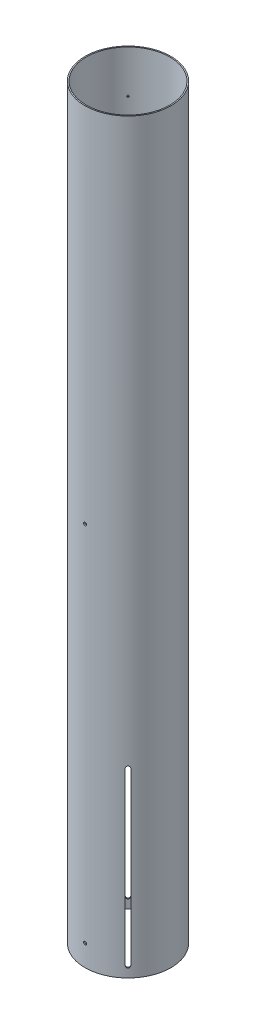
from build123d import *

# Parameters (mm, degrees)
SKETCH1_R           = 51.054
SKETCH1_R_2         = 49.657
BOSS_EXTRUDE1_DEPTH = 887.984
CUT_EXTRUDE1_DEPTH  = 152.4
CIRPATTERN1_COUNT   = 4
SKETCH3_R           = 1.7653
CUT_EXTRUDE2_DEPTH  = 11.684
SKETCH4_R           = 1.0922
CUT_EXTRUDE3_DEPTH  = 25.4
CIRPATTERN2_COUNT   = 2


with BuildPart() as part:
    # Sketch1 → Boss-Extrude1 (new body)
    with BuildSketch(Plane(origin=(0, 0, 0), x_dir=(1, 0, 0), z_dir=(0, 1, 0))):
        with Locations(Location((0, 0, 0), (0, 0, 270))):
            Circle(SKETCH1_R)
        with Locations(Location((0, 0, 0), (0, 0, 270))):
            Circle(SKETCH1_R_2, mode=Mode.SUBTRACT)
    extrude(amount=BOSS_EXTRUDE1_DEPTH)

    # Sketch2 → Cut-Extrude1 (cut)
    with BuildSketch(Plane(origin=(14.510077607, 1243.355570529, -192.646470594), x_dir=(0, 1, 0), z_dir=(0.7071067811865634, 0, -0.7071067811865316))):
        with BuildLine():
            Line((-1230.655570529, 128.342701458), (-1027.455570529, 128.342701458))
            ThreePointArc((-1027.455570529, 128.342701458), (-1025.074320529, 125.961451458), (-1027.455570529, 123.580201458))
            Line((-1027.455570529, 123.580201458), (-1230.655570529, 123.580201458))
            ThreePointArc((-1230.655570529, 123.580201458), (-1233.036820529, 125.961451458), (-1230.655570529, 128.342701458))
        make_face()
    cut_extrude1 = extrude(amount=-CUT_EXTRUDE1_DEPTH, mode=Mode.SUBTRACT)

    # CirPattern1: Cut-Extrude1 ×4 about axis
    cirpattern1_axis = Axis((0, 0, 0), (0, 1, 0))
    for i in range(1, CIRPATTERN1_COUNT):
        add(cut_extrude1.rotate(cirpattern1_axis, i * 360 / CIRPATTERN1_COUNT), mode=Mode.SUBTRACT)

    # Sketch3 → Cut-Extrude2 (cut)
    with BuildSketch(Plane(origin=(271.091614788, 1243.355570529, 52.6415), x_dir=(-1, 0, 0), z_dir=(0, 0, 1))):
        with Locations(Location((271.091614788, 1217.955570529, 0), (0, 0, 180))):
            Circle(SKETCH3_R)
        with Locations(Location((271.091614788, 786.155570529, 0), (0, 0, 180))):
            Circle(SKETCH3_R)
    extrude(amount=-CUT_EXTRUDE2_DEPTH, mode=Mode.SUBTRACT)

    # Sketch4 → Cut-Extrude3 (cut)
    with BuildSketch(Plane(origin=(120.58027232, 707.388628356, -48.738223352), x_dir=(-0.7071067811865634, 2.660214291711019e-15, 0.7071067811865317), z_dir=(0.7071067811865317, -1.2152886494782433e-14, 0.7071067811865634))):
        with Locations(Location((119.72625647, -129.795371644, 0), (0, 0, 180))):
            Circle(SKETCH4_R)
    cut_extrude3 = extrude(amount=-CUT_EXTRUDE3_DEPTH, mode=Mode.SUBTRACT)

    # CirPattern2: Cut-Extrude3 ×2 about axis
    cirpattern2_axis = Axis((0, 887.984, 0), (0, -1, 0))
    for i in range(1, CIRPATTERN2_COUNT):
        add(cut_extrude3.rotate(cirpattern2_axis, i * 360 / CIRPATTERN2_COUNT), mode=Mode.SUBTRACT)


solid = part.part
